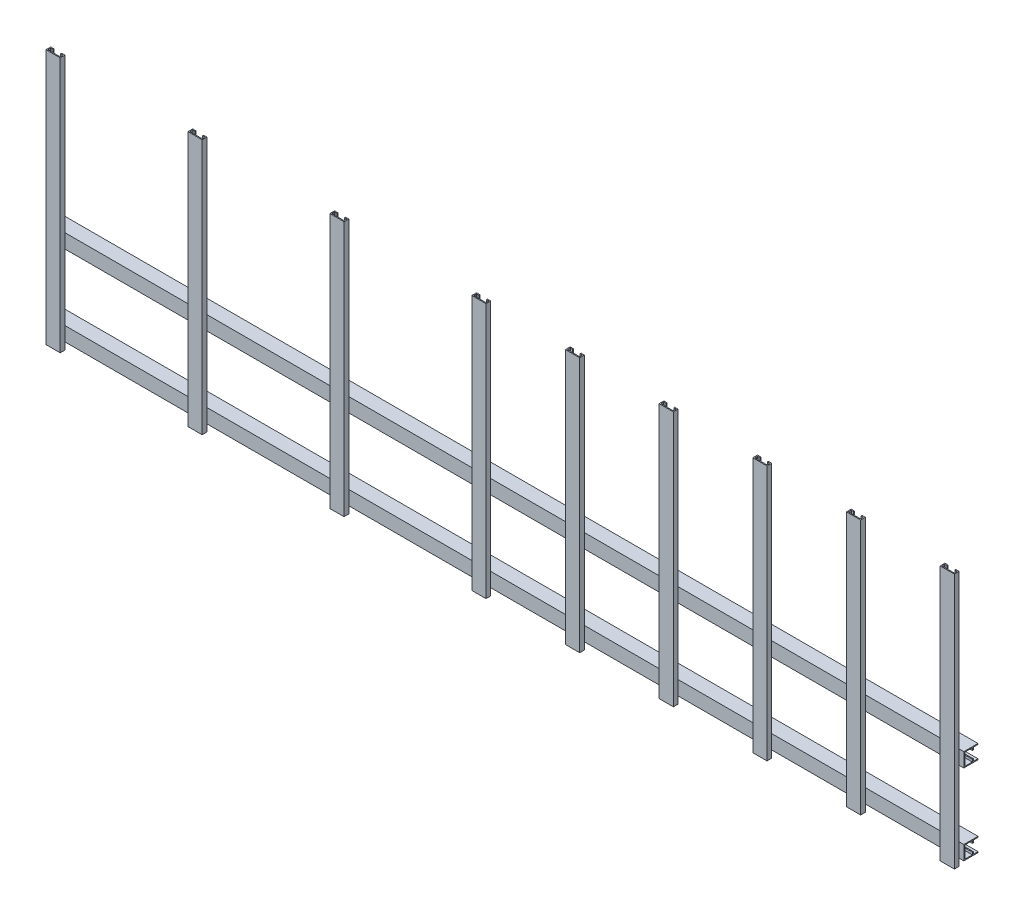
from build123d import *

# Parameters (mm, degrees)
SKETCH1_W             = 970
SKETCH1_H             = 15
BOSS_EXTRUDE1_DEPTH   = 15
BOSS_EXTRUDE1_2_DEPTH = 15
SKETCH2_W             = 15
SKETCH2_H             = 270
BOSS_EXTRUDE2_DEPTH   = 5
CUT_EXTRUDE1_DEPTH    = 556.450267801
CUT_EXTRUDE2_DEPTH    = 984.720615825


with BuildPart() as part:
    # Sketch1 → Boss-Extrude1 (new body)
    with BuildSketch(Plane.XY):
        with Locations((0, -7.5)):
            Rectangle(SKETCH1_W, SKETCH1_H)
    extrude(amount=BOSS_EXTRUDE1_DEPTH)



with BuildPart() as body_2:
    # Sketch1 → Boss-Extrude1 2 (new body)
    with BuildSketch(Plane.XY):
        with Locations((0, -92.5)):
            Rectangle(SKETCH1_W, SKETCH1_H)
    extrude(amount=BOSS_EXTRUDE1_2_DEPTH)


with BuildPart() as part_1:
    add(part.part)

    add(body_2.part)  # Boss-Extrude2 merges body 2
    # Sketch2 → Boss-Extrude2 (add)
    with BuildSketch(Plane.XY.offset(15)):
        with Locations((472.5, 27.5)):
            Rectangle(SKETCH2_W, SKETCH2_H)
        with Locations((373.5, 27.5)):
            Rectangle(SKETCH2_W, SKETCH2_H)
        with Locations((274.5, 27.5)):
            Rectangle(SKETCH2_W, SKETCH2_H)
        with Locations((175.5, 27.5)):
            Rectangle(SKETCH2_W, SKETCH2_H)
        with Locations((76.5, 27.5)):
            Rectangle(SKETCH2_W, SKETCH2_H)
        with Locations((-22.5, 27.5)):
            Rectangle(SKETCH2_W, SKETCH2_H)
        with Locations((-472.5, 27.5)):
            Rectangle(SKETCH2_W, SKETCH2_H)
        with Locations((-322.5, 27.5)):
            Rectangle(SKETCH2_W, SKETCH2_H)
        with Locations((-172.5, 27.5)):
            Rectangle(SKETCH2_W, SKETCH2_H)
    extrude(amount=BOSS_EXTRUDE2_DEPTH)

    # Sketch3 → Cut-Extrude1 (cut, through all)
    with BuildSketch(Plane(origin=(0, 162.5, 0), x_dir=(1, 0, 0), z_dir=(0, 1, 0))):
        with BuildLine():
            Line((466.5, -19), (478.5, -19))
            ThreePointArc((478.5, -19), (478.853553391, -18.853553391), (479, -18.5))
            Line((479, -18.5), (479, -16.5))
            ThreePointArc((479, -16.5), (478.853553391, -16.146446609), (478.5, -16))
            Line((478.5, -16), (476.5, -16))
            Line((476.5, -16), (476.5, -15))
            Line((476.5, -15), (468.5, -15))
            Line((468.5, -15), (468.5, -16))
            Line((468.5, -16), (466.5, -16))
            ThreePointArc((466.5, -16), (466.146446609, -16.146446609), (466, -16.5))
            Line((466, -16.5), (466, -18.5))
            ThreePointArc((466, -18.5), (466.146446609, -18.853553391), (466.5, -19))
        make_face()
        with BuildLine():
            Line((380, -18.5), (380, -16.5))
            ThreePointArc((380, -16.5), (379.853553391, -16.146446609), (379.5, -16))
            Line((379.5, -16), (377.5, -16))
            Line((377.5, -16), (377.5, -15))
            Line((377.5, -15), (369.5, -15))
            Line((369.5, -15), (369.5, -16))
            Line((369.5, -16), (367.5, -16))
            ThreePointArc((367.5, -16), (367.146446609, -16.146446609), (367, -16.5))
            Line((367, -16.5), (367, -18.5))
            ThreePointArc((367, -18.5), (367.146446609, -18.853553391), (367.5, -19))
            Line((367.5, -19), (379.5, -19))
            ThreePointArc((379.5, -19), (379.853553391, -18.853553391), (380, -18.5))
        make_face()
        with BuildLine():
            Line((281, -18.5), (281, -16.5))
            ThreePointArc((281, -16.5), (280.853553391, -16.146446609), (280.5, -16))
            Line((280.5, -16), (278.5, -16))
            Line((278.5, -16), (278.5, -15))
            Line((278.5, -15), (270.5, -15))
            Line((270.5, -15), (270.5, -16))
            Line((270.5, -16), (268.5, -16))
            ThreePointArc((268.5, -16), (268.146446609, -16.146446609), (268, -16.5))
            Line((268, -16.5), (268, -18.5))
            ThreePointArc((268, -18.5), (268.146446609, -18.853553391), (268.5, -19))
            Line((268.5, -19), (280.5, -19))
            ThreePointArc((280.5, -19), (280.853553391, -18.853553391), (281, -18.5))
        make_face()
        with BuildLine():
            Line((182, -18.5), (182, -16.5))
            ThreePointArc((182, -16.5), (181.853553391, -16.146446609), (181.5, -16))
            Line((181.5, -16), (179.5, -16))
            Line((179.5, -16), (179.5, -15))
            Line((179.5, -15), (171.5, -15))
            Line((171.5, -15), (171.5, -16))
            Line((171.5, -16), (169.5, -16))
            ThreePointArc((169.5, -16), (169.146446609, -16.146446609), (169, -16.5))
            Line((169, -16.5), (169, -18.5))
            ThreePointArc((169, -18.5), (169.146446609, -18.853553391), (169.5, -19))
            Line((169.5, -19), (181.5, -19))
            ThreePointArc((181.5, -19), (181.853553391, -18.853553391), (182, -18.5))
        make_face()
        with BuildLine():
            Line((83, -18.5), (83, -16.5))
            ThreePointArc((83, -16.5), (82.853553391, -16.146446609), (82.5, -16))
            Line((82.5, -16), (80.5, -16))
            Line((80.5, -16), (80.5, -15))
            Line((80.5, -15), (72.5, -15))
            Line((72.5, -15), (72.5, -16))
            Line((72.5, -16), (70.5, -16))
            ThreePointArc((70.5, -16), (70.146446609, -16.146446609), (70, -16.5))
            Line((70, -16.5), (70, -18.5))
            ThreePointArc((70, -18.5), (70.146446609, -18.853553391), (70.5, -19))
            Line((70.5, -19), (82.5, -19))
            ThreePointArc((82.5, -19), (82.853553391, -18.853553391), (83, -18.5))
        make_face()
        with BuildLine():
            Line((-16, -18.5), (-16, -16.5))
            ThreePointArc((-16, -16.5), (-16.146446609, -16.146446609), (-16.5, -16))
            Line((-16.5, -16), (-18.5, -16))
            Line((-18.5, -16), (-18.5, -15))
            Line((-18.5, -15), (-26.5, -15))
            Line((-26.5, -15), (-26.5, -16))
            Line((-26.5, -16), (-28.5, -16))
            ThreePointArc((-28.5, -16), (-28.853553391, -16.146446609), (-29, -16.5))
            Line((-29, -16.5), (-29, -18.5))
            ThreePointArc((-29, -18.5), (-28.853553391, -18.853553391), (-28.5, -19))
            Line((-28.5, -19), (-16.5, -19))
            ThreePointArc((-16.5, -19), (-16.146446609, -18.853553391), (-16, -18.5))
        make_face()
        with BuildLine():
            Line((-466, -18.5), (-466, -16.5))
            ThreePointArc((-466, -16.5), (-466.146446609, -16.146446609), (-466.5, -16))
            Line((-466.5, -16), (-468.5, -16))
            Line((-468.5, -16), (-468.5, -15))
            Line((-468.5, -15), (-476.5, -15))
            Line((-476.5, -15), (-476.5, -16))
            Line((-476.5, -16), (-478.5, -16))
            ThreePointArc((-478.5, -16), (-478.853553391, -16.146446609), (-479, -16.5))
            Line((-479, -16.5), (-479, -18.5))
            ThreePointArc((-479, -18.5), (-478.853553391, -18.853553391), (-478.5, -19))
            Line((-478.5, -19), (-466.5, -19))
            ThreePointArc((-466.5, -19), (-466.146446609, -18.853553391), (-466, -18.5))
        make_face()
        with BuildLine():
            Line((-316, -18.5), (-316, -16.5))
            ThreePointArc((-316, -16.5), (-316.146446609, -16.146446609), (-316.5, -16))
            Line((-316.5, -16), (-318.5, -16))
            Line((-318.5, -16), (-318.5, -15))
            Line((-318.5, -15), (-326.5, -15))
            Line((-326.5, -15), (-326.5, -16))
            Line((-326.5, -16), (-328.5, -16))
            ThreePointArc((-328.5, -16), (-328.853553391, -16.146446609), (-329, -16.5))
            Line((-329, -16.5), (-329, -18.5))
            ThreePointArc((-329, -18.5), (-328.853553391, -18.853553391), (-328.5, -19))
            Line((-328.5, -19), (-316.5, -19))
            ThreePointArc((-316.5, -19), (-316.146446609, -18.853553391), (-316, -18.5))
        make_face()
        with BuildLine():
            Line((-166, -18.5), (-166, -16.5))
            ThreePointArc((-166, -16.5), (-166.146446609, -16.146446609), (-166.5, -16))
            Line((-166.5, -16), (-168.5, -16))
            Line((-168.5, -16), (-168.5, -15))
            Line((-168.5, -15), (-176.5, -15))
            Line((-176.5, -15), (-176.5, -16))
            Line((-176.5, -16), (-178.5, -16))
            ThreePointArc((-178.5, -16), (-178.853553391, -16.146446609), (-179, -16.5))
            Line((-179, -16.5), (-179, -18.5))
            ThreePointArc((-179, -18.5), (-178.853553391, -18.853553391), (-178.5, -19))
            Line((-178.5, -19), (-166.5, -19))
            ThreePointArc((-166.5, -19), (-166.146446609, -18.853553391), (-166, -18.5))
        make_face()
    extrude(amount=-CUT_EXTRUDE1_DEPTH, mode=Mode.SUBTRACT)

    # Sketch4 → Cut-Extrude2 (cut, through all)
    with BuildSketch(Plane.ZY.offset(485)):
        Polygon((14, -1), (14, -14), (6, -14), (6, -11.5), (5, -11.5), (5, -14), (0, -14), (0, -1), (5, -1), (5, -3.5), (6, -3.5), (6, -1), align=None)
        Polygon((0, -86), (0, -99), (5, -99), (5, -96.5), (6, -96.5), (6, -99), (14, -99), (14, -86), (6, -86), (6, -88.5), (5, -88.5), (5, -86), align=None)
    extrude(amount=-CUT_EXTRUDE2_DEPTH, mode=Mode.SUBTRACT)


solid = part_1.part
